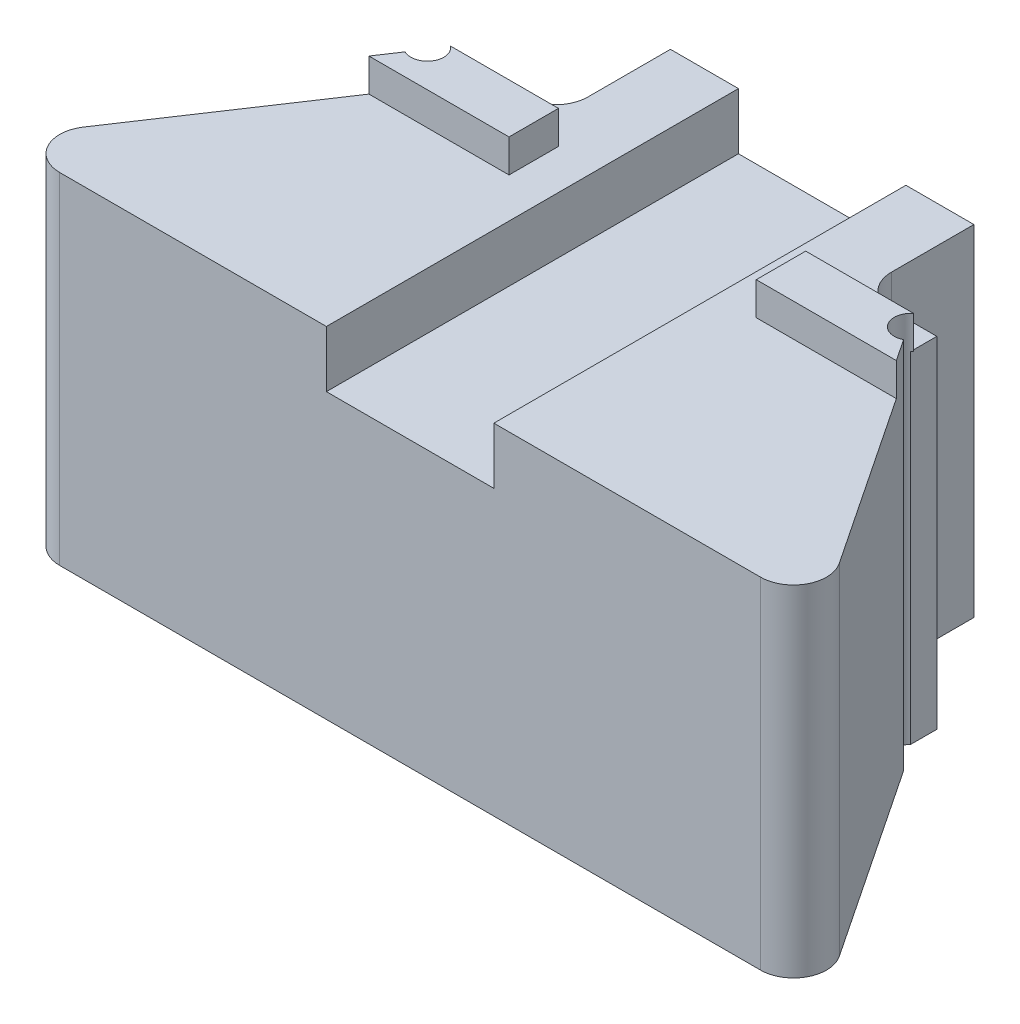
from build123d import *

# Parameters (mm, degrees)
BOSS_EXTRUDE1_DEPTH     = 10.325
CUT_EXTRUDE4_DEPTH      = 35.751582698
CUT_EXTRUDE4_DEPTH_BACK = 35.751582698
SKETCH4_W               = 0.25
SKETCH4_H               = 3
CUT_EXTRUDE5_DEPTH      = 35.751582698
CUT_EXTRUDE5_DEPTH_BACK = 35.751582698
SKETCH5_R               = 1
FILLET5_R               = 2
BOSS_EXTRUDE2_START     = 2
BOSS_EXTRUDE2_DEPTH     = 2
SKETCH7_W               = 10.16
SKETCH7_H               = 3.425
CUT_EXTRUDE6_DEPTH      = 37.305250358


with BuildPart() as part:
    # Sketch1 → Boss-Extrude1 (new, symmetric)
    with BuildSketch(Plane(origin=(0, 0, 0), x_dir=(1, 0, 0), z_dir=(0, 1, 0))):
        Polygon((-15, -12.5), (15, -12.5), (25, -12.5), (15, 2.5), (14.20625, 2.5), (14.20625, 5.5), (9.20625, 5.5), (9.20625, 12.5), (-9.20625, 12.5), (-9.20625, 5.5), (-14.20625, 5.5), (-14.20625, 2.5), (-15, 2.5), (-25, -12.5), align=None)
    extrude(amount=BOSS_EXTRUDE1_DEPTH, both=True)

    # Sketch4 → Cut-Extrude4 (cut, two sides: drawn at the far end of the back side and taken through both)
    with BuildSketch(Plane(origin=(0, 10.325, 0), x_dir=(1, 0, 0), z_dir=(0, 1, 0)).offset(-CUT_EXTRUDE4_DEPTH_BACK)):
        with Locations((14.08125, 4)):
            Rectangle(SKETCH4_W, SKETCH4_H)
        with Locations((-14.08125, 4)):
            Rectangle(SKETCH4_W, SKETCH4_H)
    extrude(amount=CUT_EXTRUDE4_DEPTH + CUT_EXTRUDE4_DEPTH_BACK, mode=Mode.SUBTRACT)

    # Sketch5 → Cut-Extrude5 (cut, two sides: drawn at the far end of the back side and taken through both)
    with BuildSketch(Plane(origin=(0, 10.325, 0), x_dir=(1, 0, 0), z_dir=(0, 1, 0)).offset(-CUT_EXTRUDE5_DEPTH_BACK)):
        with Locations((-14.663356781, 3.207106781)):
            Circle(SKETCH5_R)
        with Locations((14.663356781, 3.207106781)):
            Circle(SKETCH5_R)
    extrude(amount=CUT_EXTRUDE5_DEPTH + CUT_EXTRUDE5_DEPTH_BACK, mode=Mode.SUBTRACT)

    # Fillet5
    fillet5_edges = [part.edges().sort_by_distance(p)[0] for p in [
        (-25, 0, 12.5),
        (-9.20625, 0, -5.5),
        (9.20625, 0, -5.5),
        (25, 0, 12.5),
    ]]
    fillet(fillet5_edges, radius=FILLET5_R)

    # Sketch6 → Boss-Extrude2 (add)
    with BuildSketch(Plane(origin=(0, 10.325, 0), x_dir=(1, 0, 0), z_dir=(0, 1, 0)).offset(BOSS_EXTRUDE2_START)):
        with BuildLine():
            Line((-14.053996179, 4), (-7.5, 4))
            Line((-7.5, 4), (-7.5, 1))
            Line((-7.5, 1), (-16, 1))
            Line((-16, 1), (-15.121262614, 2.318106079))
            ThreePointArc((-15.121262614, 2.318106079), (-13.819007075, 2.671314309), (-14.053996179, 4))
        make_face()
        with BuildLine():
            Line((16, 1), (15.121262614, 2.318106079))
            ThreePointArc((15.121262614, 2.318106079), (13.819007075, 2.671314309), (14.053996179, 4))
            Line((14.053996179, 4), (7.5, 4))
            Line((7.5, 4), (7.5, 1))
            Line((7.5, 1), (16, 1))
        make_face()
    extrude(amount=-BOSS_EXTRUDE2_DEPTH)

    # Sketch7 → Cut-Extrude6 (cut, through all)
    with BuildSketch(Plane.XY.offset(12.5)):
        with Locations((0, 8.6125)):
            Rectangle(SKETCH7_W, SKETCH7_H)
    extrude(amount=-CUT_EXTRUDE6_DEPTH, mode=Mode.SUBTRACT)


solid = part.part
